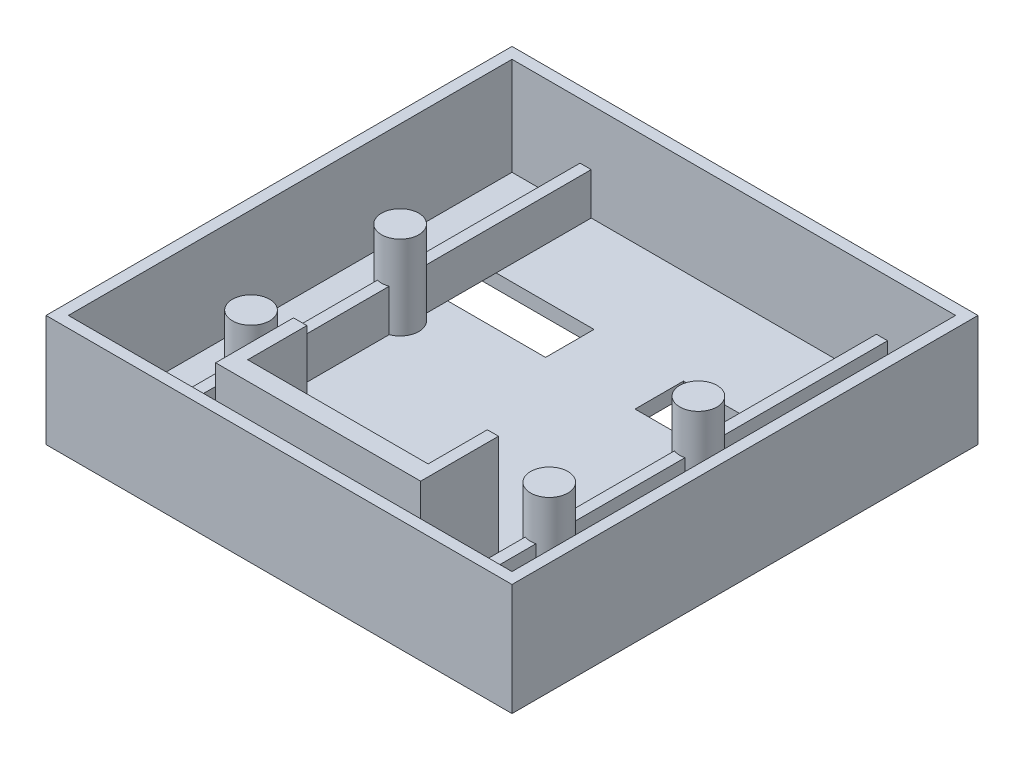
from build123d import *

# Parameters (mm, degrees)
CROQUIS1_W              = 100
CROQUIS1_H              = 100
PLACABASE_DEPTH         = 3
CROQUIS2_W              = 100
CROQUIS2_H              = 100
CROQUIS2_W_2            = 95.2
CROQUIS2_H_2            = 95.2
PAREDES_DEPTH           = 21
CROQUIS4_W              = 26.4
CROQUIS4_H              = 10.4
ALOJAMIENTOSMOTOR_DEPTH = 12.4
CROQUIS6_W              = 2.4
CROQUIS6_H              = 95.2
NERVIOSRIGIDEZ_DEPTH    = 9
CROQUIS7_W              = 95.2
CROQUIS7_H              = 6
BLOQUECUNA_DEPTH        = 10
CROQUIS8_W              = 44
CROQUIS8_H              = 4
TORRESENSORES_DEPTH     = 22
CROQUIS11_W             = 2.875664279
CROQUIS11_H             = 12.708105518
CROQUIS11_W_2           = 2.4
NERVIOSTORRE_DEPTH      = 22
CROQUIS12_R             = 4
POSTESPLACA_DEPTH       = 18


with BuildPart() as part:
    # Croquis1 → PlacaBase (new body)
    with BuildSketch(Plane(origin=(0, 0, 0), x_dir=(1, 0, 0), z_dir=(0, 1, 0))):
        with Locations((50, 50)):
            Rectangle(CROQUIS1_W, CROQUIS1_H)
    extrude(amount=PLACABASE_DEPTH)

    # Croquis2 → Paredes (add)
    with BuildSketch(Plane(origin=(0, 3, 0), x_dir=(1, 0, 0), z_dir=(0, 1, 0))):
        with Locations((50, 50)):
            Rectangle(CROQUIS2_W, CROQUIS2_H)
        with Locations((50, 50)):
            Rectangle(CROQUIS2_W_2, CROQUIS2_H_2, mode=Mode.SUBTRACT)
    extrude(amount=PAREDES_DEPTH)

    # Croquis4 → AlojamientosMotor (cut)
    with BuildSketch(Plane(origin=(0, 7.3, 0), x_dir=(1, 0, 0), z_dir=(0, 1, 0))):
        with Locations((27.2, 72)):
            Rectangle(CROQUIS4_W, CROQUIS4_H)
        with Locations((72.8, 72)):
            Rectangle(CROQUIS4_W, CROQUIS4_H)
    extrude(amount=-ALOJAMIENTOSMOTOR_DEPTH, mode=Mode.SUBTRACT)

    # Croquis6 → NerviosRigidez (add)
    with BuildSketch(Plane(origin=(0, 3, 0), x_dir=(1, 0, 0), z_dir=(0, 1, 0))):
        with Locations((18.2, 50)):
            Rectangle(CROQUIS6_W, CROQUIS6_H)
        with Locations((81.8, 50)):
            Rectangle(CROQUIS6_W, CROQUIS6_H)
    extrude(amount=NERVIOSRIGIDEZ_DEPTH)

    # Croquis7 → BloqueCuna (add)
    with BuildSketch(Plane(origin=(0, 3, 0), x_dir=(1, 0, 0), z_dir=(0, 1, 0))):
        with Locations((50, 5.4)):
            Rectangle(CROQUIS7_W, CROQUIS7_H)
    extrude(amount=BLOQUECUNA_DEPTH)

    # Croquis8 → TorreSensores (add)
    with BuildSketch(Plane(origin=(0, 3, 0), x_dir=(1, 0, 0), z_dir=(0, 1, 0))):
        with Locations((50, 10.4)):
            Rectangle(CROQUIS8_W, CROQUIS8_H)
    extrude(amount=TORRESENSORES_DEPTH)

    # Croquis11 → NerviosTorre (add)
    with BuildSketch(Plane(origin=(0, 3, 0), x_dir=(1, 0, 0), z_dir=(0, 1, 0))):
        with Locations((29.43783214, 18.754052759)):
            Rectangle(CROQUIS11_W, CROQUIS11_H)
        with Locations((70.8, 18.754052759)):
            Rectangle(CROQUIS11_W_2, CROQUIS11_H)
    extrude(amount=NERVIOSTORRE_DEPTH)

    # Croquis12 → PostesPlaca (add)
    with BuildSketch(Plane(origin=(0, 3, 0), x_dir=(1, 0, 0), z_dir=(0, 1, 0))):
        with Locations(Location((18, 26, 0), (0, 0, 104.477512186))):
            Circle(CROQUIS12_R)
        with Locations(Location((82, 26, 0), (0, 0, 75.522487814))):
            Circle(CROQUIS12_R)
        with Locations(Location((18, 58, 0), (0, 0, 104.477512186))):
            Circle(CROQUIS12_R)
        with Locations(Location((82, 58, 0), (0, 0, 75.522487814))):
            Circle(CROQUIS12_R)
    extrude(amount=POSTESPLACA_DEPTH)


solid = part.part
